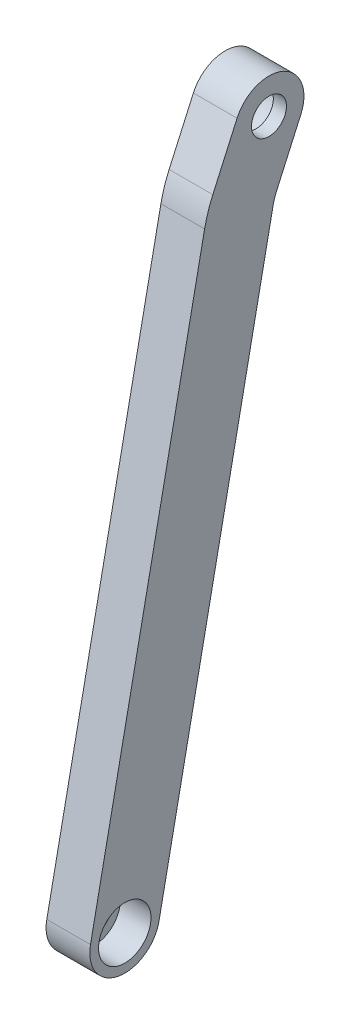
from build123d import *

# Parameters (mm, degrees)
BOSS_EXTRUDE1_START = -0.65
BOSS_EXTRUDE1_DEPTH = 5
CUT_EXTRUDE1_START  = -5.65
SKETCH2_3_R         = 3
SKETCH2_3_R_2       = 2
CUT_EXTRUDE1_DEPTH  = 3.5
CUT_EXTRUDE2_START  = -2.15
SKETCH2_4_R         = 2
CUT_EXTRUDE2_DEPTH  = 1.5
CUT_EXTRUDE3_START  = -4.15
SKETCH2_5_R         = 3
CUT_EXTRUDE3_DEPTH  = 3.5
CUT_EXTRUDE4_START  = -5.65
SKETCH2_6_R         = 2
CUT_EXTRUDE4_DEPTH  = 1.5


with BuildPart() as part:
    # Sketch2 → Boss-Extrude1 (new body)
    with BuildSketch(Plane(origin=(0, 0, 0), x_dir=(0, 0, -1), z_dir=(1, 0, 0)).offset(BOSS_EXTRUDE1_START)):
        with BuildLine():
            Line((0.474149458, -9.067560136), (-12.581681775, -73.461136983))
            ThreePointArc((-12.581681775, -73.461136983), (-17.296746951, -76.586542619), (-20.422152587, -71.871477443))
            Line((-20.422152587, -71.871477443), (-7.366321354, -7.477900597))
            ThreePointArc((-7.366321354, -7.477900597), (-6.977161002, -5.987839937), (-6.425552448, -4.549975356))
            Line((-6.425552448, -4.549975356), (-3.649510541, 1.637398184))
            ThreePointArc((-3.649510541, 1.637398184), (1.637398184, 3.649510541), (3.649510541, -1.637398184))
            Line((3.649510541, -1.637398184), (0.873468634, -7.824771725))
            ThreePointArc((0.873468634, -7.824771725), (0.639332629, -8.435088345), (0.474149458, -9.067560136))
        make_face()
    extrude(amount=-BOSS_EXTRUDE1_DEPTH)

    # Sketch2<3> → Cut-Extrude1 (cut)
    # profile 1 of 2: a face of its own
    with BuildSketch(Plane(origin=(0, 0, 0), x_dir=(0, 0, -1), z_dir=(1, 0, 0)).offset(CUT_EXTRUDE1_START)):
        with Locations(Location((0, 0, 0), (0, 0, 180))):
            Circle(SKETCH2_3_R)
        Circle(SKETCH2_3_R_2, mode=Mode.SUBTRACT)
    # profile 2 of 2: a face of its own
    with BuildSketch(Plane(origin=(0, 0, 0), x_dir=(0, 0, -1), z_dir=(1, 0, 0)).offset(CUT_EXTRUDE1_START)):
        Circle(SKETCH2_3_R_2)
    extrude(amount=CUT_EXTRUDE1_DEPTH, mode=Mode.SUBTRACT)

    # Sketch2<4> → Cut-Extrude2 (cut)
    with BuildSketch(Plane(origin=(0, 0, 0), x_dir=(0, 0, -1), z_dir=(1, 0, 0)).offset(CUT_EXTRUDE2_START)):
        Circle(SKETCH2_4_R)
    extrude(amount=CUT_EXTRUDE2_DEPTH, mode=Mode.SUBTRACT)

    # Sketch2<5> → Cut-Extrude3 (cut)
    with BuildSketch(Plane(origin=(0, 0, 0), x_dir=(0, 0, -1), z_dir=(1, 0, 0)).offset(CUT_EXTRUDE3_START)):
        with Locations((-16.501917181, -72.666307213)):
            Circle(SKETCH2_5_R)
    extrude(amount=CUT_EXTRUDE3_DEPTH, mode=Mode.SUBTRACT)

    # Sketch2<6> → Cut-Extrude4 (cut)
    with BuildSketch(Plane(origin=(0, 0, 0), x_dir=(0, 0, -1), z_dir=(1, 0, 0)).offset(CUT_EXTRUDE4_START)):
        with Locations((-16.501917181, -72.666307213)):
            Circle(SKETCH2_6_R)
    extrude(amount=CUT_EXTRUDE4_DEPTH, mode=Mode.SUBTRACT)


solid = part.part
